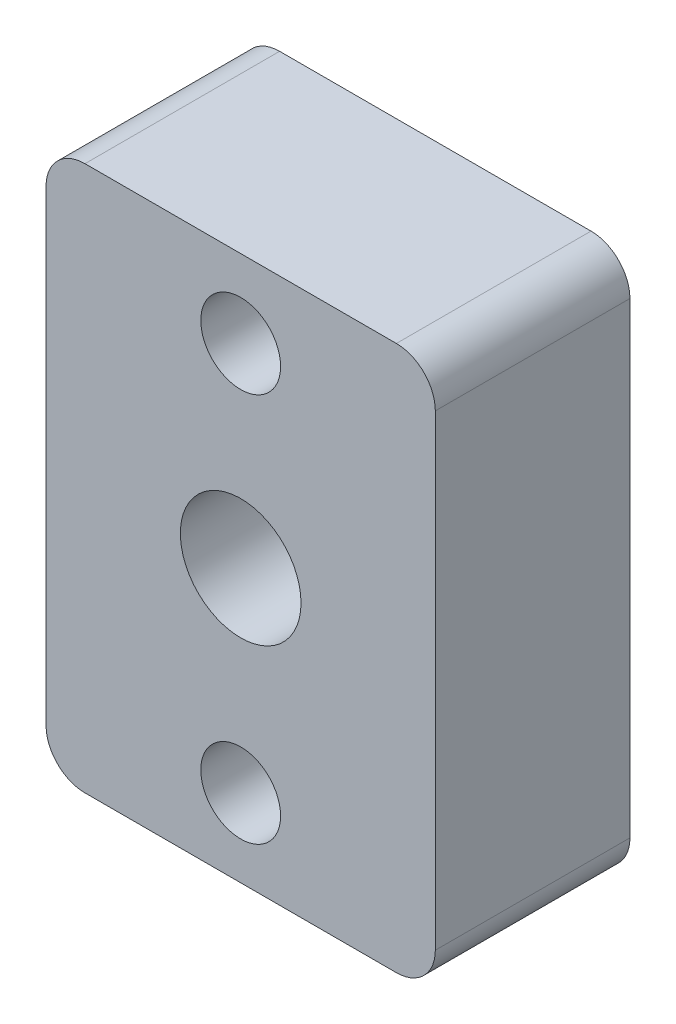
from build123d import *

# Parameters (mm, degrees)
SKETCH_1_W      = 20
SKETCH_1_H      = 28
SKETCH_1_R      = 2.05
SKETCH_1_R_2    = 3.1
EXTRUDE_2_DEPTH = 5
FILLET_1_R      = 2


with BuildPart() as part:
    # 草图1 → 凸台-拉伸2 (new, symmetric)
    with BuildSketch(Plane.XY):
        Rectangle(SKETCH_1_W, SKETCH_1_H)
        with Locations((0, 10)):
            Circle(SKETCH_1_R, mode=Mode.SUBTRACT)
        with Locations((0, -10)):
            Circle(SKETCH_1_R, mode=Mode.SUBTRACT)
        Circle(SKETCH_1_R_2, mode=Mode.SUBTRACT)
    extrude(amount=EXTRUDE_2_DEPTH, both=True)

    # 圆角1
    fillet_1_edges = [part.edges().sort_by_distance(p)[0] for p in [
        (10, -14, 0),
        (-10, -14, 0),
        (-10, 14, 0),
        (10, 14, 0),
    ]]
    fillet(fillet_1_edges, radius=FILLET_1_R)


solid = part.part
